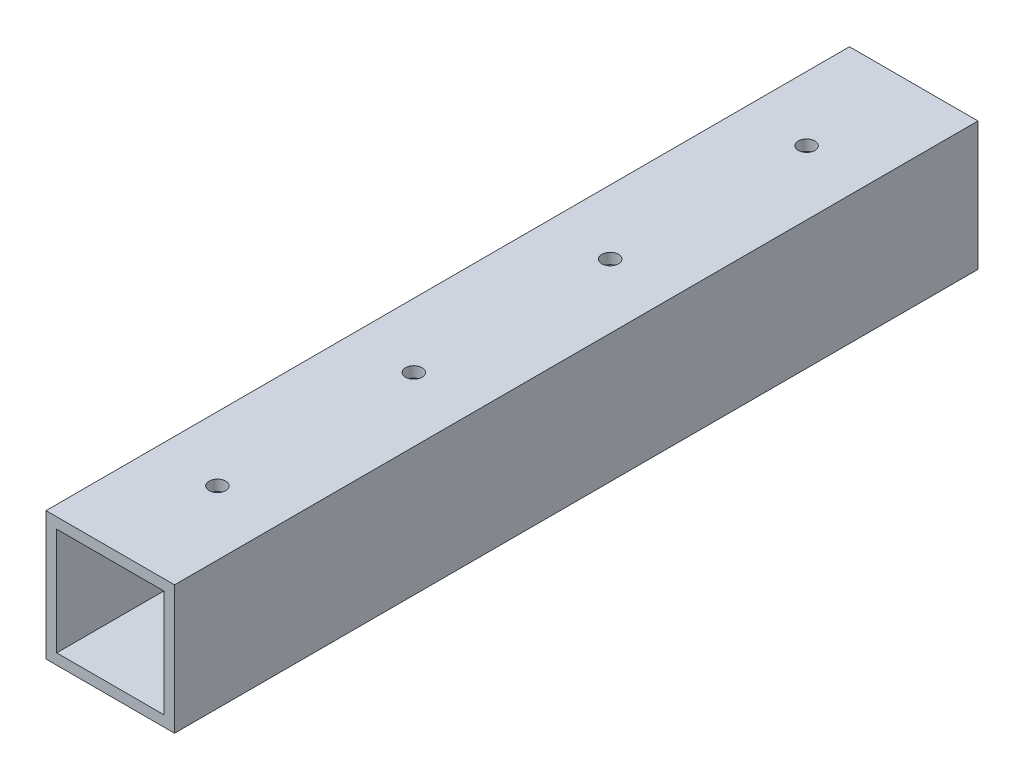
from build123d import *

# Parameters (mm, degrees)
SKETCH1_W                    = 38.1
SKETCH1_H                    = 38.1
SKETCH1_W_2                  = 31.75
SKETCH1_H_2                  = 31.75
BOSS_EXTRUDE1_DEPTH          = 238.125
F_10_0_1935_DIAMETER_HOLE2_D = 4.9149


with BuildPart() as part:
    # Sketch1 → Boss-Extrude1 (new body)
    with BuildSketch(Plane.XY):
        Rectangle(SKETCH1_W, SKETCH1_H)
        Rectangle(SKETCH1_W_2, SKETCH1_H_2, mode=Mode.SUBTRACT)
    extrude(amount=BOSS_EXTRUDE1_DEPTH)

    # #10 (0.1935) Diameter Hole2 (through all)
    with Locations(Plane(origin=(0, 19.05, 0), x_dir=(1, 0, 0), z_dir=(0, 1, 0))):
        with Locations((0, -31.75), (0, -89.958333333), (0, -148.166666667), (0, -206.375)):
            Hole(F_10_0_1935_DIAMETER_HOLE2_D / 2)


solid = part.part
